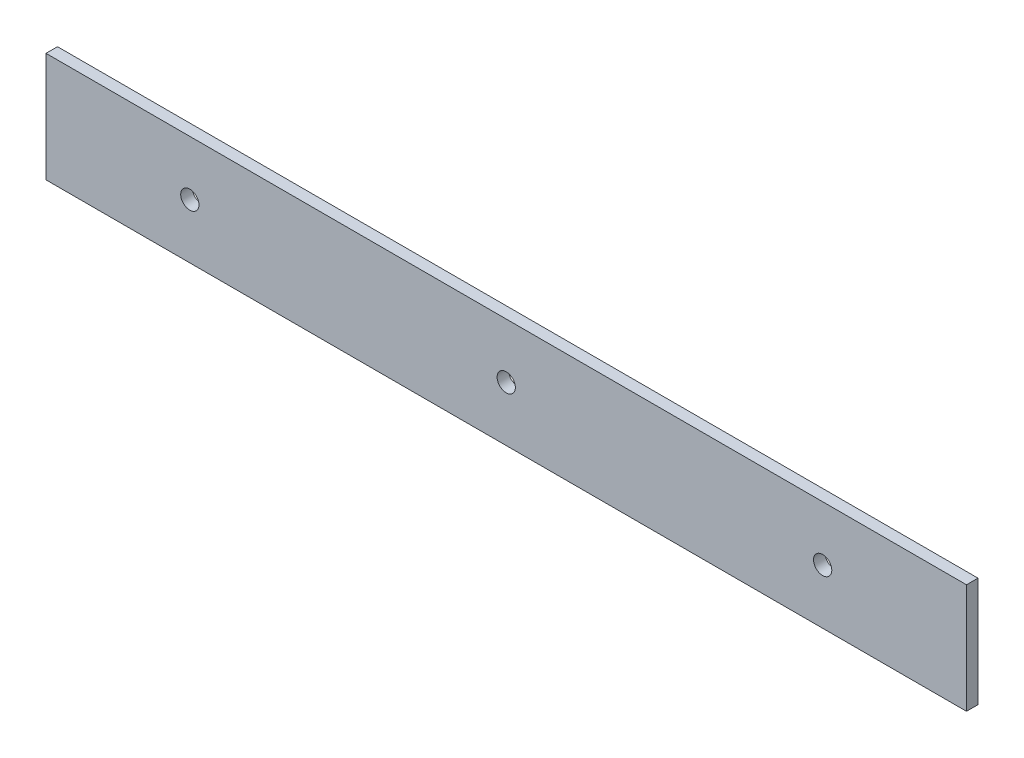
from build123d import *

# Parameters (mm, degrees)
CROQUIS1_W              = 320
CROQUIS1_H              = 38.1
SALIENTE_EXTRUIR1_DEPTH = 4
CROQUIS2_R              = 3.175
CORTAR_EXTRUIR1_DEPTH   = 10


with BuildPart() as part:
    # Croquis1 → Saliente-Extruir1 (new body)
    with BuildSketch(Plane.XY):
        Rectangle(CROQUIS1_W, CROQUIS1_H)
    extrude(amount=SALIENTE_EXTRUIR1_DEPTH)

    # Croquis2 → Cortar-Extruir1 (cut)
    with BuildSketch(Plane.XY.offset(4)):
        with Locations((110, 0)):
            Circle(CROQUIS2_R)
        Circle(CROQUIS2_R)
        with Locations((-110, 0)):
            Circle(CROQUIS2_R)
    extrude(amount=-CORTAR_EXTRUIR1_DEPTH, mode=Mode.SUBTRACT)


solid = part.part
